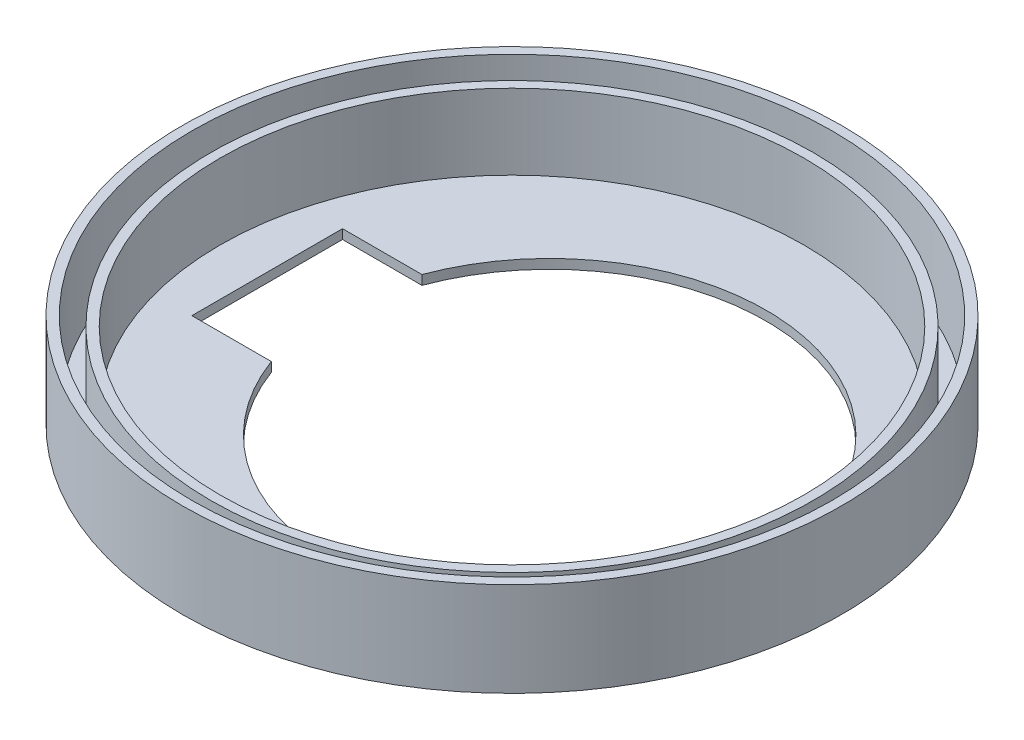
from build123d import *

# Parameters (mm, degrees)
SKETCH1_R           = 17.5
BOSS_EXTRUDE1_DEPTH = 0.5
SKETCH2_R           = 11.5
CUT_EXTRUDE1_DEPTH  = 0.5
SKETCH3_W           = 15
SKETCH3_H           = 8
CUT_EXTRUDE4_DEPTH  = 2.5
SKETCH4_R           = 16
SKETCH4_R_2         = 15.5
BOSS_EXTRUDE2_DEPTH = 4.5
SKETCH6_R           = 17.5
SKETCH6_R_2         = 17
BOSS_EXTRUDE4_DEPTH = 4.5


with BuildPart() as part:
    # Sketch1 → Boss-Extrude1 (new body)
    with BuildSketch(Plane(origin=(0, 0, 0), x_dir=(1, 0, 0), z_dir=(0, 1, 0))):
        with Locations(Location((0, 0, 0), (0, 0, 270))):
            Circle(SKETCH1_R)
    extrude(amount=BOSS_EXTRUDE1_DEPTH)

    # Sketch2 → Cut-Extrude1 (cut)
    with BuildSketch(Plane(origin=(0, 0.5, 0), x_dir=(1, 0, 0), z_dir=(0, 1, 0))):
        with Locations(Location((2, 0, 0), (0, 0, 270))):
            Circle(SKETCH2_R)
    extrude(amount=-CUT_EXTRUDE1_DEPTH, mode=Mode.SUBTRACT)

    # Sketch3 → Cut-Extrude4 (cut)
    with BuildSketch(Plane(origin=(0, 0, 0), x_dir=(1, 0, 0), z_dir=(0, 1, 0))):
        with Locations((-5.5, 0)):
            Rectangle(SKETCH3_W, SKETCH3_H)
    extrude(amount=CUT_EXTRUDE4_DEPTH, mode=Mode.SUBTRACT)

    # Sketch4 → Boss-Extrude2 (add)
    with BuildSketch(Plane(origin=(0, 0, 0), x_dir=(1, 0, 0), z_dir=(0, 1, 0))):
        with Locations(Location((0, 0, 0), (0, 0, 270))):
            Circle(SKETCH4_R)
        with Locations(Location((0, 0, 0), (0, 0, 270))):
            Circle(SKETCH4_R_2, mode=Mode.SUBTRACT)
    extrude(amount=BOSS_EXTRUDE2_DEPTH)

    # Sketch6 → Boss-Extrude4 (add)
    with BuildSketch(Plane(origin=(0, 0.5, 0), x_dir=(1, 0, 0), z_dir=(0, 1, 0))):
        with Locations(Location((0, 0, 0), (0, 0, 270))):
            Circle(SKETCH6_R)
        with Locations(Location((0, 0, 0), (0, 0, 270))):
            Circle(SKETCH6_R_2, mode=Mode.SUBTRACT)
    extrude(amount=BOSS_EXTRUDE4_DEPTH)


solid = part.part
